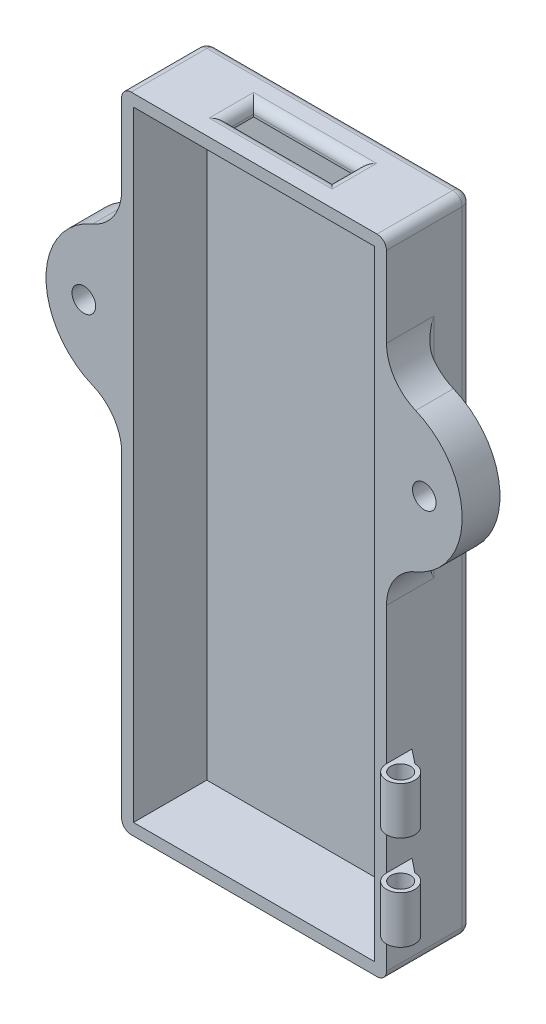
from build123d import *

# Parameters (mm, degrees)
SKETCH1_W           = 28
SKETCH1_H           = 68
BOSS_EXTRUDE1_DEPTH = 1.25
SKETCH7_W           = 28
SKETCH7_H           = 68
SKETCH7_W_2         = 25.5
SKETCH7_H_2         = 65.5
BOSS_EXTRUDE4_DEPTH = 7.75
SKETCH18_W          = 11
SKETCH18_H          = 2.7
CUT_EXTRUDE10_DEPTH = 1.25
SKETCH13_R          = 1.05
BOSS_EXTRUDE7_DEPTH = 5
LPATTERN2_COUNT     = 4
LPATTERN2_PITCH     = 5
SKETCH14_W          = 10
SKETCH14_H          = 5
CUT_EXTRUDE5_DEPTH  = 5
FILLET1_R           = 1
SKETCH6_R           = 1.25
BOSS_EXTRUDE3_DEPTH = 4
FILLET3_R           = 5
FILLET4_R           = 1
FILLET7_R           = 1


with BuildPart() as part:
    # Sketch1 → Boss-Extrude1 (new body)
    with BuildSketch(Plane.XY):
        with Locations((-2.825688073, -2.660550459)):
            Rectangle(SKETCH1_W, SKETCH1_H)
    extrude(amount=BOSS_EXTRUDE1_DEPTH)

    # Sketch7 → Boss-Extrude4 (add)
    with BuildSketch(Plane.XY.offset(1.25)):
        with Locations((-2.825688073, -2.660550459)):
            Rectangle(SKETCH7_W, SKETCH7_H)
        with Locations((-2.825688073, -2.660550459)):
            Rectangle(SKETCH7_W_2, SKETCH7_H_2, mode=Mode.SUBTRACT)
    extrude(amount=BOSS_EXTRUDE4_DEPTH)

    # Sketch18 → Cut-Extrude10 (cut)
    with BuildSketch(Plane(origin=(0, 31.339449541, 0), x_dir=(1, 0, 0), z_dir=(0, 1, 0))):
        with Locations((-2.825688073, -4.9)):
            Rectangle(SKETCH18_W, SKETCH18_H)
    extrude(amount=-CUT_EXTRUDE10_DEPTH, mode=Mode.SUBTRACT)

    # Sketch13 → Boss-Extrude7 (add)
    with BuildSketch(Plane.XZ.offset(36.660550459)):
        with BuildLine():
            Line((12.674311927, 7.5), (11.174311927, 6.303164343))
            Line((11.174311927, 6.303164343), (11.174311927, 9))
            ThreePointArc((11.174311927, 9), (13.734972098, 10.060660172), (12.674311927, 7.5))
        make_face()
        with Locations(Location((12.674311927, 9, 0), (0, 0, 270))):
            Circle(SKETCH13_R, mode=Mode.SUBTRACT)
    boss_extrude7 = extrude(amount=-BOSS_EXTRUDE7_DEPTH)

    # LPattern2: Boss-Extrude7 ×4, 1 skipped
    with Locations(*[(0, i * LPATTERN2_PITCH, 0) for i in range(1, LPATTERN2_COUNT) if i not in (2,)]):
        add(boss_extrude7)

    # Sketch14 → Cut-Extrude5 (cut)
    with BuildSketch(Plane(origin=(11.174311927, 0, 0), x_dir=(0, 0, -1), z_dir=(1, 0, 0))):
        with Locations((-8.964747177, -34.160550459)):
            Rectangle(SKETCH14_W, SKETCH14_H)
    extrude(amount=CUT_EXTRUDE5_DEPTH, mode=Mode.SUBTRACT)

    # Fillet1
    fillet1_edges = [part.edges().sort_by_distance(p)[0] for p in [
        (-2.825688073, 31.339449541, 0),
        (11.174311927, -2.660550459, 0),
        (11.174311927, -36.660550459, 4.5),
        (-2.825688073, -36.660550459, 0),
        (-16.825688073, -2.660550459, 0),
        (-16.825688073, 31.339449541, 4.5),
        (11.174311927, 31.339449541, 4.5),
        (-16.825688073, -36.660550459, 4.5),
    ]]
    fillet(fillet1_edges, radius=FILLET1_R)

    # Sketch6 → Boss-Extrude3 (add)
    # profile 1 of 2: a face of its own
    with BuildSketch(Plane.XY.offset(9)):
        with BuildLine():
            Line((-16.825688073, 1.839449541), (-16.825688073, 17.839449541))
            ThreePointArc((-16.825688073, 17.839449541), (-24.825688073, 9.839449541), (-16.825688073, 1.839449541))
        make_face()
        with Locations((-20.825688073, 9.839449541)):
            Circle(SKETCH6_R, mode=Mode.SUBTRACT)
    # profile 2 of 2: a face of its own
    with BuildSketch(Plane.XY.offset(9)):
        with BuildLine():
            Line((11.174311927, 1.839449541), (11.174311927, 17.839449541))
            ThreePointArc((11.174311927, 17.839449541), (19.174311927, 9.839449541), (11.174311927, 1.839449541))
        make_face()
        with Locations(Location((15.174311927, 9.839449541, 0), (0, 0, 180))):
            Circle(SKETCH6_R, mode=Mode.SUBTRACT)
    extrude(amount=-BOSS_EXTRUDE3_DEPTH)

    # Fillet3
    fillet3_edges = [part.edges().sort_by_distance(p)[0] for p in [
        (-16.825688073, 1.839449541, 7),
        (-16.825688073, 17.839449541, 7),
        (11.174311927, 17.839449541, 7),
        (11.174311927, 1.839449541, 7),
    ]]
    fillet(fillet3_edges, radius=FILLET3_R)

    # Fillet4
    fillet4_edges = [part.edges().sort_by_distance(p)[0] for p in [
        (-16.825688073, 9.839449541, 5),
        (11.174311927, 9.839449541, 5),
    ]]
    fillet(fillet4_edges, radius=FILLET4_R)

    # Fillet7
    fillet7_edges = [part.edges().sort_by_distance(p)[0] for p in [
        (2.674311927, 31.339449541, 4.9),
        (-2.825688073, 31.339449541, 3.55),
        (-8.325688073, 31.339449541, 4.9),
        (-2.825688073, 31.339449541, 6.25),
    ]]
    fillet(fillet7_edges, radius=FILLET7_R)


solid = part.part
